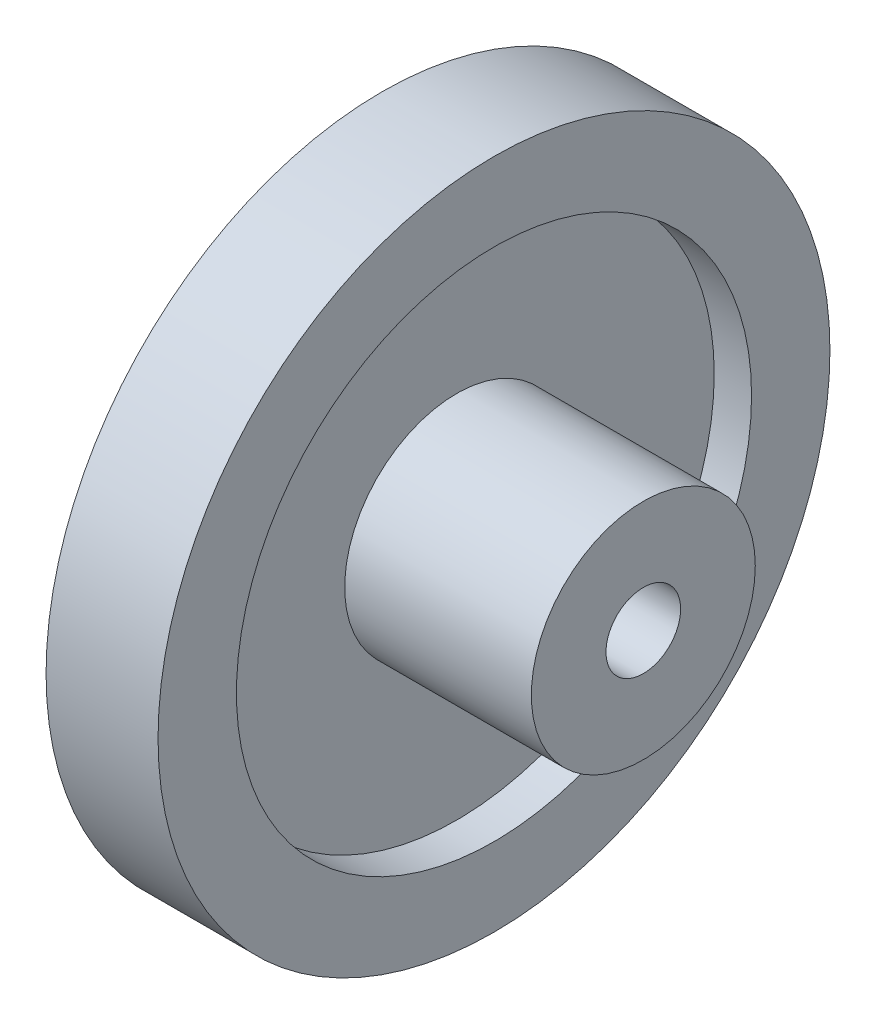
from build123d import *

# Parameters (mm, degrees)
ESQUISSE2_R             = 1
BOSS_EXTRU_1_DEPTH      = 3
ESQUISSE3_R             = 6.9
ENL_V_MAT_EXTRU_1_DEPTH = 1
ESQUISSE4_R             = 1
BOSS_EXTRU_2_DEPTH      = 5
BOSS_EXTRU_3_START      = -5
ESQUISSE6_R             = 3
ESQUISSE6_R_2           = 1
BOSS_EXTRU_3_DEPTH      = 5
BOSS_EXTRU_4_START      = -3
ESQUISSE7_R             = 9
ESQUISSE7_R_2           = 6.9
BOSS_EXTRU_4_DEPTH      = 3


with BuildPart() as part:
    # Esquisse2 → Boss.-Extru.1 (new body)
    with BuildSketch(Plane(origin=(0, 0, 0), x_dir=(0, 0, -1), z_dir=(1, 0, 0))):
        with BuildLine():
            ThreePointArc((8.992678526, 0.362950305), (8.983203595, 0.549593642), (8.969855294, 0.736000007))
            add(Edge.make_bspline(
                [(7.928017131, 0.973718567), (7.968735547, 0.978720051), (8.14599471, 0.972060465), (8.43210917, 0.923262044), (8.735368899, 0.829543111), (8.90576586, 0.762906571), (8.969855294, 0.736000007)],
                knots=[0, 0, 0, 0, 0.124841327, 0.52877899, 0.867841808, 1.076016146, 1.076016146, 1.076016146, 1.076016146], degree=3))
            ThreePointArc((7.928017131, 0.973718567), (7.845145349, 0.995861242), (7.801971612, 1.069983161))
            ThreePointArc((7.801971612, 1.069983161), (7.782401197, 1.204099918), (7.760525474, 1.337859996))
            ThreePointArc((7.760525474, 1.337859996), (7.7791127, 1.421320515), (7.851006147, 1.467607399))
            add(Edge.make_bspline(
                [(7.851006147, 1.467607399), (7.891911369, 1.47525391), (8.058869705, 1.535171146), (8.316858832, 1.668153777), (8.577616241, 1.849137964), (8.719907754, 1.964153953), (8.772869142, 2.009170729)],
                knots=[0, 0, 0, 0, 0.124841327, 0.52877899, 0.867841808, 1.076016146, 1.076016146, 1.076016146, 1.076016146], degree=3))
            ThreePointArc((8.772869142, 2.009170729), (8.729259916, 2.190895095), (8.681886815, 2.371674793))
            add(Edge.make_bspline(
                [(7.614107256, 2.413908484), (7.653213344, 2.426306797), (7.828678029, 2.452331888), (8.118887532, 2.456937748), (8.434204497, 2.420538386), (8.613944558, 2.38634682), (8.681886815, 2.371674793)],
                knots=[0, 0, 0, 0, 0.124841327, 0.52877899, 0.867841808, 1.076016146, 1.076016146, 1.076016146, 1.076016146], degree=3))
            ThreePointArc((7.614107256, 2.413908484), (7.528577818, 2.420446487), (7.472519329, 2.485373186))
            ThreePointArc((7.472519329, 2.485373186), (7.428638248, 2.613610296), (7.382556651, 2.741073201))
            ThreePointArc((7.382556651, 2.741073201), (7.385491564, 2.82652804), (7.447655696, 2.885237188))
            add(Edge.make_bspline(
                [(7.447655696, 2.885237188), (7.486459386, 2.900269817), (7.639565176, 2.989845363), (7.868726054, 3.167969089), (8.091787815, 3.393785724), (8.210522412, 3.532989345), (8.254310221, 3.586971254)],
                knots=[0, 0, 0, 0, 0.124841327, 0.52877899, 0.867841808, 1.076016146, 1.076016146, 1.076016146, 1.076016146], degree=3))
            ThreePointArc((8.254310221, 3.586971254), (8.17805176, 3.757588243), (8.098267094, 3.926585039))
            add(Edge.make_bspline(
                [(7.040908091, 3.771895641), (7.077070139, 3.791268575), (7.244765106, 3.849092091), (7.529186917, 3.906945383), (7.845823377, 3.92910513), (8.028785705, 3.928522889), (8.098267094, 3.926585039)],
                knots=[0, 0, 0, 0, 0.124841327, 0.52877899, 0.867841808, 1.076016146, 1.076016146, 1.076016146, 1.076016146], degree=3))
            ThreePointArc((7.040908091, 3.771895641), (6.955633599, 3.76260633), (6.888599363, 3.816126808))
            ThreePointArc((6.888599363, 3.816126808), (6.821901934, 3.93411731), (6.753183716, 4.050942446))
            ThreePointArc((6.753183716, 4.050942446), (6.740366371, 4.135481543), (6.790684263, 4.204613685))
            add(Edge.make_bspline(
                [(6.790684263, 4.204613685), (6.826065008, 4.226520515), (6.960104418, 4.342703981), (7.152633247, 4.559903013), (7.33040326, 4.822862182), (7.421537577, 4.981513022), (7.454660665, 5.042621775)],
                knots=[0, 0, 0, 0, 0.124841327, 0.52877899, 0.867841808, 1.076016146, 1.076016146, 1.076016146, 1.076016146], degree=3))
            ThreePointArc((7.454660665, 5.042621775), (7.34834986, 5.19632123), (7.2388706, 5.34778014))
            add(Edge.make_bspline(
                [(6.227939246, 5.001435417), (6.259925799, 5.027123248), (6.414140397, 5.114776078), (6.683088872, 5.223906679), (6.990262151, 5.303870911), (7.170216185, 5.336917824), (7.2388706, 5.34778014)],
                knots=[0, 0, 0, 0, 0.124841327, 0.52877899, 0.867841808, 1.076016146, 1.076016146, 1.076016146, 1.076016146], degree=3))
            ThreePointArc((6.227939246, 5.001435417), (6.14582362, 4.976635127), (6.070096408, 5.016926809))
            ThreePointArc((6.070096408, 5.016926809), (5.982853931, 5.120652678), (5.893839209, 5.222861704))
            ThreePointArc((5.893839209, 5.222861704), (5.865706085, 5.303606182), (5.902464222, 5.380807106))
            add(Edge.make_bspline(
                [(5.902464222, 5.380807106), (5.933217173, 5.408842125), (6.043625651, 5.547677024), (6.192966094, 5.79655491), (6.319390614, 6.087701853), (6.379821181, 6.260397247), (6.401151581, 6.32655186)],
                knots=[0, 0, 0, 0, 0.124841327, 0.52877899, 0.867841808, 1.076016146, 1.076016146, 1.076016146, 1.076016146], degree=3))
            ThreePointArc((6.401151581, 6.32655186), (6.268408719, 6.45809973), (6.13296305, 6.586863003))
            add(Edge.make_bspline(
                [(5.202885399, 6.060657308), (5.229607193, 6.091785269), (5.36508983, 6.206282501), (5.60940625, 6.362974098), (5.896655932, 6.498019729), (6.067473552, 6.563570423), (6.13296305, 6.586863003)],
                knots=[0, 0, 0, 0, 0.124841327, 0.52877899, 0.867841808, 1.076016146, 1.076016146, 1.076016146, 1.076016146], degree=3))
            ThreePointArc((5.202885399, 6.060657308), (5.126724989, 6.021190583), (5.044883599, 6.046881384))
            ThreePointArc((5.044883599, 6.046881384), (4.940067013, 6.13281036), (4.833787077, 6.216922671))
            ThreePointArc((4.833787077, 6.216922671), (4.791296214, 6.291122873), (4.813242841, 6.373763594))
            add(Edge.make_bspline(
                [(4.813242841, 6.373763594), (4.838320743, 6.406972104), (4.921338461, 6.563730579), (5.022404908, 6.835812081), (5.0931787, 7.145232139), (5.120847626, 7.326091153), (5.129658958, 7.395038808)],
                knots=[0, 0, 0, 0, 0.124841327, 0.52877899, 0.867841808, 1.076016146, 1.076016146, 1.076016146, 1.076016146], degree=3))
            ThreePointArc((5.129658958, 7.395038808), (4.975004437, 7.49995539), (4.818204799, 7.601638147))
            add(Edge.make_bspline(
                [(4.00065353, 6.913490784), (4.021200587, 6.948998848), (4.133337563, 7.086441417), (4.344702027, 7.285358066), (4.602246167, 7.470886279), (4.758110384, 7.566708503), (4.818204799, 7.601638147)],
                knots=[0, 0, 0, 0, 0.124841327, 0.52877899, 0.867841808, 1.076016146, 1.076016146, 1.076016146, 1.076016146], degree=3))
            ThreePointArc((4.00065353, 6.913490784), (3.933041887, 6.860701616), (3.84787333, 6.870916666))
            ThreePointArc((3.84787333, 6.870916666), (3.729052038, 6.936122541), (3.609126123, 6.999273793))
            ThreePointArc((3.609126123, 6.999273793), (3.553724497, 7.06440292), (3.560112248, 7.149669208))
            add(Edge.make_bspline(
                [(3.560112248, 7.149669208), (3.578661103, 7.186920332), (3.631460993, 7.356264162), (3.680811746, 7.64228387), (3.693524693, 7.959440113), (3.687489747, 8.142303811), (3.683481951, 8.21169658)],
                knots=[0, 0, 0, 0, 0.124841327, 0.52877899, 0.867841808, 1.076016146, 1.076016146, 1.076016146, 1.076016146], degree=3))
            ThreePointArc((3.683481951, 8.21169658), (3.512182346, 8.286409063), (3.339368362, 8.35754862))
            add(Edge.make_bspline(
                [(2.662184203, 7.530893622), (2.675856818, 7.569572607), (2.760829443, 7.72528007), (2.932044187, 7.959647903), (3.151112429, 8.189340757), (3.286715474, 8.3121714), (3.339368362, 8.35754862)],
                knots=[0, 0, 0, 0, 0.124841327, 0.52877899, 0.867841808, 1.076016146, 1.076016146, 1.076016146, 1.076016146], degree=3))
            ThreePointArc((2.662184203, 7.530893622), (2.605423761, 7.466579684), (2.51982835, 7.460971122))
            ThreePointArc((2.51982835, 7.460971122), (2.391048668, 7.503233388), (2.261560708, 7.543273041))
            ThreePointArc((2.261560708, 7.543273041), (2.195134954, 7.597113198), (2.185746302, 7.682101412))
            add(Edge.make_bspline(
                [(2.185746302, 7.682101412), (2.197134452, 7.722126608), (2.217918476, 7.898288992), (2.213872956, 8.188506848), (2.168092134, 8.502598901), (2.128558827, 8.681240079), (2.111868384, 8.748714873)],
                knots=[0, 0, 0, 0, 0.124841327, 0.52877899, 0.867841808, 1.076016146, 1.076016146, 1.076016146, 1.076016146], degree=3))
            ThreePointArc((2.111868384, 8.748714873), (1.929757098, 8.790679015), (1.74681374, 8.8288528))
            add(Edge.make_bspline(
                [(1.233057386, 7.891840911), (1.239389954, 7.932373648), (1.294304588, 8.101043575), (1.419539098, 8.362881478), (1.592671336, 8.628917058), (1.70339541, 8.77457327), (1.74681374, 8.8288528)],
                knots=[0, 0, 0, 0, 0.124841327, 0.52877899, 0.867841808, 1.076016146, 1.076016146, 1.076016146, 1.076016146], degree=3))
            ThreePointArc((1.233057386, 7.891840911), (1.189081054, 7.818192336), (1.105973638, 7.796951155))
            ThreePointArc((1.105973638, 7.796951155), (0.971621004, 7.81483062), (0.836980555, 7.830395172))
            ThreePointArc((0.836980555, 7.830395172), (0.761792723, 7.871112898), (0.736947387, 7.952928866))
            add(Edge.make_bspline(
                [(0.736947387, 7.952928866), (0.740787022, 7.994365125), (0.728847405, 8.171347063), (0.671543377, 8.455880046), (0.568827797, 8.756211882), (0.49714239, 8.924547128), (0.468337672, 8.987806174)],
                knots=[0, 0, 0, 0, 0.124841327, 0.52877899, 0.867841808, 1.076016146, 1.076016146, 1.076016146, 1.076016146], degree=3))
            ThreePointArc((0.468337672, 8.987806174), (0.281616286, 8.995592936), (0.094773472, 8.999500986))
            add(Edge.make_bspline(
                [(-0.238059721, 7.984041022), (-0.239282848, 8.02504722), (-0.216296258, 8.200935757), (-0.141306691, 8.481327153), (-0.020006268, 8.774645937), (0.062068259, 8.938167571), (0.094773472, 8.999500986)],
                knots=[0, 0, 0, 0, 0.124841327, 0.52877899, 0.867841808, 1.076016146, 1.076016146, 1.076016146, 1.076016146], degree=3))
            ThreePointArc((-0.238059721, 7.984041022), (-0.267754383, 7.903565825), (-0.34554368, 7.867415368))
            ThreePointArc((-0.34554368, 7.867415368), (-0.480894049, 7.860303169), (-0.616101967, 7.850862587))
            ThreePointArc((-0.616101967, 7.850862587), (-0.697491446, 7.877071289), (-0.736947387, 7.952928866))
            add(Edge.make_bspline(
                [(-0.736947387, 7.952928866), (-0.740787022, 7.994365125), (-0.78504369, 8.166139711), (-0.893654807, 8.435298391), (-1.049807289, 8.711642568), (-1.151203635, 8.863939428), (-1.191141718, 8.920828516)],
                knots=[0, 0, 0, 0, 0.124841327, 0.52877899, 0.867841808, 1.076016146, 1.076016146, 1.076016146, 1.076016146], degree=3))
            ThreePointArc((-1.191141718, 8.920828516), (-1.376114631, 8.894172728), (-1.560494193, 8.863681959))
            add(Edge.make_bspline(
                [(-1.70106999, 7.804354193), (-1.70980716, 7.844437433), (-1.719531394, 8.021554909), (-1.697340451, 8.310951405), (-1.632002584, 8.621564774), (-1.581372552, 8.797383295), (-1.560494193, 8.863681959)],
                knots=[0, 0, 0, 0, 0.124841327, 0.52877899, 0.867841808, 1.076016146, 1.076016146, 1.076016146, 1.076016146], degree=3))
            ThreePointArc((-1.70106999, 7.804354193), (-1.715471765, 7.719792859), (-1.785293922, 7.669964186))
            ThreePointArc((-1.785293922, 7.669964186), (-1.917032831, 7.638102521), (-2.048203875, 7.603978293))
            ThreePointArc((-2.048203875, 7.603978293), (-2.13302338, 7.614785465), (-2.185746302, 7.682101412))
            add(Edge.make_bspline(
                [(-2.185746302, 7.682101412), (-2.197134452, 7.722126608), (-2.272201064, 7.882844264), (-2.428420647, 8.127462766), (-2.632692446, 8.370408715), (-2.760346802, 8.501480902), (-2.810058205, 8.550062742)],
                knots=[0, 0, 0, 0, 0.124841327, 0.52877899, 0.867841808, 1.076016146, 1.076016146, 1.076016146, 1.076016146], degree=3))
            ThreePointArc((-2.810058205, 8.550062742), (-2.986983615, 8.489872136), (-3.1626211, 8.426020875))
            add(Edge.make_bspline(
                [(-3.106152361, 7.358899441), (-3.12210604, 7.396694737), (-3.164209951, 7.569009628), (-3.195573318, 7.857556174), (-3.188423008, 8.174886562), (-3.170961618, 8.357014683), (-3.1626211, 8.426020875)],
                knots=[0, 0, 0, 0, 0.124841327, 0.52877899, 0.867841808, 1.076016146, 1.076016146, 1.076016146, 1.076016146], degree=3))
            ThreePointArc((-3.106152361, 7.358899441), (-3.104770813, 7.273131606), (-3.164248122, 7.211321573))
            ThreePointArc((-3.164248122, 7.211321573), (-3.287889359, 7.155795453), (-3.410556657, 7.098149639))
            ThreePointArc((-3.410556657, 7.098149639), (-3.49591776, 7.093187254), (-3.560112248, 7.149669208))
            add(Edge.make_bspline(
                [(-3.560112248, 7.149669208), (-3.578661103, 7.186920332), (-3.681981355, 7.331108011), (-3.880489536, 7.542856145), (-4.125924419, 7.744130633), (-4.275489668, 7.84951464), (-4.33328153, 7.888134836)],
                knots=[0, 0, 0, 0, 0.124841327, 0.52877899, 0.867841808, 1.076016146, 1.076016146, 1.076016146, 1.076016146], degree=3))
            ThreePointArc((-4.33328153, 7.888134836), (-4.496134454, 7.79645913), (-4.657048739, 7.701421755))
            add(Edge.make_bspline(
                [(-4.405458438, 6.662846196), (-4.428085343, 6.697066474), (-4.501135134, 6.858710803), (-4.584984768, 7.136581292), (-4.636265512, 7.449822393), (-4.652567389, 7.632057959), (-4.657048739, 7.701421755)],
                knots=[0, 0, 0, 0, 0.124841327, 0.52877899, 0.867841808, 1.076016146, 1.076016146, 1.076016146, 1.076016146], degree=3))
            ThreePointArc((-4.405458438, 6.662846196), (-4.388340616, 6.578792579), (-4.435447646, 6.507106053))
            ThreePointArc((-4.435447646, 6.507106053), (-4.546780759, 6.429806352), (-4.656767022, 6.350602011))
            ThreePointArc((-4.656767022, 6.350602011), (-4.739762855, 6.330039059), (-4.813242841, 6.373763594))
            add(Edge.make_bspline(
                [(-4.813242841, 6.373763594), (-4.838320743, 6.406972104), (-4.966376188, 6.529719667), (-5.200413007, 6.701386604), (-5.478652985, 6.85413547), (-5.645035862, 6.930242572), (-5.70894015, 6.957585958)],
                knots=[0, 0, 0, 0, 0.124841327, 0.52877899, 0.867841808, 1.076016146, 1.076016146, 1.076016146, 1.076016146], degree=3))
            ThreePointArc((-5.70894015, 6.957585958), (-5.852174827, 6.83754706), (-5.992886168, 6.714559954))
            add(Edge.make_bspline(
                [(-5.554741912, 5.739897714), (-5.58327151, 5.769377644), (-5.684779557, 5.914846807), (-5.81826006, 6.172578694), (-5.926225553, 6.471063457), (-5.975735558, 6.647200654), (-5.992886168, 6.714559954)],
                knots=[0, 0, 0, 0, 0.124841327, 0.52877899, 0.867841808, 1.076016146, 1.076016146, 1.076016146, 1.076016146], degree=3))
            ThreePointArc((-5.554741912, 5.739897714), (-5.522470742, 5.660420661), (-5.555603321, 5.58129884))
            ThreePointArc((-5.555603321, 5.58129884), (-5.650836993, 5.484857908), (-5.744396771, 5.386792249))
            ThreePointArc((-5.744396771, 5.386792249), (-5.82220101, 5.351328976), (-5.902464222, 5.380807106))
            add(Edge.make_bspline(
                [(-5.902464222, 5.380807106), (-5.933217173, 5.408842125), (-6.081647036, 5.505969552), (-6.34324265, 5.63170938), (-6.644812595, 5.730730945), (-6.82234713, 5.774969405), (-6.89018766, 5.790104836)],
                knots=[0, 0, 0, 0, 0.124841327, 0.52877899, 0.867841808, 1.076016146, 1.076016146, 1.076016146, 1.076016146], degree=3))
            ThreePointArc((-6.89018766, 5.790104836), (-7.008926405, 5.645790525), (-7.124643046, 5.499041868))
            add(Edge.make_bspline(
                [(-6.514865313, 4.6214839), (-6.548326063, 4.645219578), (-6.674835631, 4.769559798), (-6.853401485, 4.998376331), (-7.014375092, 5.271940217), (-7.095407219, 5.435980904), (-7.124643046, 5.499041868)],
                knots=[0, 0, 0, 0, 0.124841327, 0.52877899, 0.867841808, 1.076016146, 1.076016146, 1.076016146, 1.076016146], degree=3))
            ThreePointArc((-6.514865313, 4.6214839), (-6.46853975, 4.549289907), (-6.486569587, 4.46542719))
            ThreePointArc((-6.486569587, 4.46542719), (-6.562460751, 4.353129207), (-6.636407979, 4.239541737))
            ThreePointArc((-6.636407979, 4.239541737), (-6.706371093, 4.190385802), (-6.790684263, 4.204613685))
            add(Edge.make_bspline(
                [(-6.790684263, 4.204613685), (-6.826065008, 4.226520515), (-6.989814688, 4.294720246), (-7.270060773, 4.370251048), (-7.584691081, 4.41217325), (-7.767331549, 4.423036581), (-7.836798093, 4.425448638)],
                knots=[0, 0, 0, 0, 0.124841327, 0.52877899, 0.867841808, 1.076016146, 1.076016146, 1.076016146, 1.076016146], degree=3))
            ThreePointArc((-7.836798093, 4.425448638), (-7.9269974, 4.261773366), (-8.013778751, 4.096260505))
            add(Edge.make_bspline(
                [(-7.253132789, 3.345690994), (-7.290385226, 3.362874131), (-7.437588183, 3.46185115), (-7.655158542, 3.653960257), (-7.863658499, 3.893287376), (-7.973453297, 4.039645344), (-8.013778751, 4.096260505)],
                knots=[0, 0, 0, 0, 0.124841327, 0.52877899, 0.867841808, 1.076016146, 1.076016146, 1.076016146, 1.076016146], degree=3))
            ThreePointArc((-7.253132789, 3.345690994), (-7.194330395, 3.283238541), (-7.196643507, 3.197490772))
            ThreePointArc((-7.196643507, 3.197490772), (-7.250607779, 3.073159911), (-7.302424271, 2.947918717))
            ThreePointArc((-7.302424271, 2.947918717), (-7.362163751, 2.886744066), (-7.447655696, 2.885237188))
            add(Edge.make_bspline(
                [(-7.447655696, 2.885237188), (-7.486459386, 2.900269817), (-7.659952585, 2.937219394), (-7.949305695, 2.959969057), (-8.266282009, 2.943364287), (-8.447808808, 2.920482551), (-8.516535767, 2.910089094)],
                knots=[0, 0, 0, 0, 0.124841327, 0.52877899, 0.867841808, 1.076016146, 1.076016146, 1.076016146, 1.076016146], degree=3))
            ThreePointArc((-8.516535767, 2.910089094), (-8.575124006, 2.732626625), (-8.630014832, 2.553985905))
            add(Edge.make_bspline(
                [(-7.744403527, 1.955964595), (-7.784179063, 1.966010038), (-7.94706259, 2.036253313), (-8.196228356, 2.185112949), (-8.445154448, 2.382053302), (-8.579972987, 2.505744507), (-8.630014832, 2.553985905)],
                knots=[0, 0, 0, 0, 0.124841327, 0.52877899, 0.867841808, 1.076016146, 1.076016146, 1.076016146, 1.076016146], degree=3))
            ThreePointArc((-7.744403527, 1.955964595), (-7.675126748, 1.905380425), (-7.661644363, 1.820667641))
            ThreePointArc((-7.661644363, 1.820667641), (-7.691844055, 1.68853784), (-7.719765264, 1.55590786))
            ThreePointArc((-7.719765264, 1.55590786), (-7.767246753, 1.484797724), (-7.851006147, 1.467607399))
            add(Edge.make_bspline(
                [(-7.851006147, 1.467607399), (-7.891911369, 1.47525391), (-8.069239983, 1.479695059), (-8.357846547, 1.448888871), (-8.666374618, 1.374322583), (-8.84060607, 1.318474991), (-8.906253029, 1.295629957)],
                knots=[0, 0, 0, 0, 0.124841327, 0.52877899, 0.867841808, 1.076016146, 1.076016146, 1.076016146, 1.076016146], degree=3))
            ThreePointArc((-8.906253029, 1.295629957), (-8.93123505, 1.110423563), (-8.952366108, 0.924738377))
            add(Edge.make_bspline(
                [(-7.971947891, 0.499630167), (-8.012892019, 0.502195832), (-8.185909312, 0.541313312), (-8.458185443, 0.641854241), (-8.73906079, 0.78970126), (-8.894311987, 0.886513545), (-8.952366108, 0.924738377)],
                knots=[0, 0, 0, 0, 0.124841327, 0.52877899, 0.867841808, 1.076016146, 1.076016146, 1.076016146, 1.076016146], degree=3))
            ThreePointArc((-7.971947891, 0.499630167), (-7.894555864, 0.462636863), (-7.865737109, 0.381843858))
            ThreePointArc((-7.865737109, 0.381843858), (-7.871143807, 0.246414639), (-7.874218909, 0.110912427))
            ThreePointArc((-7.874218909, 0.110912427), (-7.907825483, 0.032288375), (-7.987, 0))
            add(Edge.make_bspline(
                [(-7.987, 0), (-8.028613776, 0), (-8.203739092, -0.028218518), (-8.481770958, -0.111531489), (-8.771344233, -0.241520028), (-8.932347096, -0.328431654), (-8.992678526, -0.362950305)],
                knots=[0, 0, 0, 0, 0.124841327, 0.52877899, 0.867841808, 1.076016146, 1.076016146, 1.076016146, 1.076016146], degree=3))
            ThreePointArc((-8.992678526, -0.362950305), (-8.983203595, -0.549593642), (-8.969855294, -0.736000007))
            add(Edge.make_bspline(
                [(-7.928017131, -0.973718567), (-7.968735547, -0.978720051), (-8.14599471, -0.972060465), (-8.43210917, -0.923262044), (-8.735368899, -0.829543111), (-8.90576586, -0.762906571), (-8.969855294, -0.736000007)],
                knots=[0, 0, 0, 0, 0.124841327, 0.52877899, 0.867841808, 1.076016146, 1.076016146, 1.076016146, 1.076016146], degree=3))
            ThreePointArc((-7.928017131, -0.973718567), (-7.845145349, -0.995861242), (-7.801971612, -1.069983161))
            ThreePointArc((-7.801971612, -1.069983161), (-7.782401197, -1.204099918), (-7.760525474, -1.337859996))
            ThreePointArc((-7.760525474, -1.337859996), (-7.7791127, -1.421320515), (-7.851006147, -1.467607399))
            add(Edge.make_bspline(
                [(-7.851006147, -1.467607399), (-7.891911369, -1.47525391), (-8.058869705, -1.535171146), (-8.316858832, -1.668153777), (-8.577616241, -1.849137964), (-8.719907754, -1.964153953), (-8.772869142, -2.009170729)],
                knots=[0, 0, 0, 0, 0.124841327, 0.52877899, 0.867841808, 1.076016146, 1.076016146, 1.076016146, 1.076016146], degree=3))
            ThreePointArc((-8.772869142, -2.009170729), (-8.729259916, -2.190895095), (-8.681886815, -2.371674793))
            add(Edge.make_bspline(
                [(-7.614107256, -2.413908484), (-7.653213344, -2.426306797), (-7.828678029, -2.452331888), (-8.118887532, -2.456937748), (-8.434204497, -2.420538386), (-8.613944558, -2.38634682), (-8.681886815, -2.371674793)],
                knots=[0, 0, 0, 0, 0.124841327, 0.52877899, 0.867841808, 1.076016146, 1.076016146, 1.076016146, 1.076016146], degree=3))
            ThreePointArc((-7.614107256, -2.413908484), (-7.528577818, -2.420446487), (-7.472519329, -2.485373186))
            ThreePointArc((-7.472519329, -2.485373186), (-7.428638248, -2.613610296), (-7.382556651, -2.741073201))
            ThreePointArc((-7.382556651, -2.741073201), (-7.385491564, -2.82652804), (-7.447655696, -2.885237188))
            add(Edge.make_bspline(
                [(-7.447655696, -2.885237188), (-7.486459386, -2.900269817), (-7.639565176, -2.989845363), (-7.868726054, -3.167969089), (-8.091787815, -3.393785724), (-8.210522412, -3.532989345), (-8.254310221, -3.586971254)],
                knots=[0, 0, 0, 0, 0.124841327, 0.52877899, 0.867841808, 1.076016146, 1.076016146, 1.076016146, 1.076016146], degree=3))
            ThreePointArc((-8.254310221, -3.586971254), (-8.17805176, -3.757588243), (-8.098267094, -3.926585039))
            add(Edge.make_bspline(
                [(-7.040908091, -3.771895641), (-7.077070139, -3.791268575), (-7.244765106, -3.849092091), (-7.529186917, -3.906945383), (-7.845823377, -3.92910513), (-8.028785705, -3.928522889), (-8.098267094, -3.926585039)],
                knots=[0, 0, 0, 0, 0.124841327, 0.52877899, 0.867841808, 1.076016146, 1.076016146, 1.076016146, 1.076016146], degree=3))
            ThreePointArc((-7.040908091, -3.771895641), (-6.955633599, -3.76260633), (-6.888599363, -3.816126808))
            ThreePointArc((-6.888599363, -3.816126808), (-6.821901934, -3.93411731), (-6.753183716, -4.050942446))
            ThreePointArc((-6.753183716, -4.050942446), (-6.740366371, -4.135481543), (-6.790684263, -4.204613685))
            add(Edge.make_bspline(
                [(-6.790684263, -4.204613685), (-6.826065008, -4.226520515), (-6.960104418, -4.342703981), (-7.152633247, -4.559903013), (-7.33040326, -4.822862182), (-7.421537577, -4.981513022), (-7.454660665, -5.042621775)],
                knots=[0, 0, 0, 0, 0.124841327, 0.52877899, 0.867841808, 1.076016146, 1.076016146, 1.076016146, 1.076016146], degree=3))
            ThreePointArc((-7.454660665, -5.042621775), (-7.34834986, -5.19632123), (-7.2388706, -5.34778014))
            add(Edge.make_bspline(
                [(-6.227939246, -5.001435417), (-6.259925799, -5.027123248), (-6.414140397, -5.114776078), (-6.683088872, -5.223906679), (-6.990262151, -5.303870911), (-7.170216185, -5.336917824), (-7.2388706, -5.34778014)],
                knots=[0, 0, 0, 0, 0.124841327, 0.52877899, 0.867841808, 1.076016146, 1.076016146, 1.076016146, 1.076016146], degree=3))
            ThreePointArc((-6.227939246, -5.001435417), (-6.14582362, -4.976635127), (-6.070096408, -5.016926809))
            ThreePointArc((-6.070096408, -5.016926809), (-5.982853931, -5.120652678), (-5.893839209, -5.222861704))
            ThreePointArc((-5.893839209, -5.222861704), (-5.865706085, -5.303606182), (-5.902464222, -5.380807106))
            add(Edge.make_bspline(
                [(-5.902464222, -5.380807106), (-5.933217173, -5.408842125), (-6.043625651, -5.547677024), (-6.192966094, -5.79655491), (-6.319390614, -6.087701853), (-6.379821181, -6.260397247), (-6.401151581, -6.32655186)],
                knots=[0, 0, 0, 0, 0.124841327, 0.52877899, 0.867841808, 1.076016146, 1.076016146, 1.076016146, 1.076016146], degree=3))
            ThreePointArc((-6.401151581, -6.32655186), (-6.268408719, -6.45809973), (-6.13296305, -6.586863003))
            add(Edge.make_bspline(
                [(-5.202885399, -6.060657308), (-5.229607193, -6.091785269), (-5.36508983, -6.206282501), (-5.60940625, -6.362974098), (-5.896655932, -6.498019729), (-6.067473552, -6.563570423), (-6.13296305, -6.586863003)],
                knots=[0, 0, 0, 0, 0.124841327, 0.52877899, 0.867841808, 1.076016146, 1.076016146, 1.076016146, 1.076016146], degree=3))
            ThreePointArc((-5.202885399, -6.060657308), (-5.126724989, -6.021190583), (-5.044883599, -6.046881384))
            ThreePointArc((-5.044883599, -6.046881384), (-4.940067013, -6.13281036), (-4.833787077, -6.216922671))
            ThreePointArc((-4.833787077, -6.216922671), (-4.791296214, -6.291122873), (-4.813242841, -6.373763594))
            add(Edge.make_bspline(
                [(-4.813242841, -6.373763594), (-4.838320743, -6.406972104), (-4.921338461, -6.563730579), (-5.022404908, -6.835812081), (-5.0931787, -7.145232139), (-5.120847626, -7.326091153), (-5.129658958, -7.395038808)],
                knots=[0, 0, 0, 0, 0.124841327, 0.52877899, 0.867841808, 1.076016146, 1.076016146, 1.076016146, 1.076016146], degree=3))
            ThreePointArc((-5.129658958, -7.395038808), (-4.975004437, -7.49995539), (-4.818204799, -7.601638147))
            add(Edge.make_bspline(
                [(-4.00065353, -6.913490784), (-4.021200587, -6.948998848), (-4.133337563, -7.086441417), (-4.344702027, -7.285358066), (-4.602246167, -7.470886279), (-4.758110384, -7.566708503), (-4.818204799, -7.601638147)],
                knots=[0, 0, 0, 0, 0.124841327, 0.52877899, 0.867841808, 1.076016146, 1.076016146, 1.076016146, 1.076016146], degree=3))
            ThreePointArc((-4.00065353, -6.913490784), (-3.933041887, -6.860701616), (-3.84787333, -6.870916666))
            ThreePointArc((-3.84787333, -6.870916666), (-3.729052038, -6.936122541), (-3.609126123, -6.999273793))
            ThreePointArc((-3.609126123, -6.999273793), (-3.553724497, -7.06440292), (-3.560112248, -7.149669208))
            add(Edge.make_bspline(
                [(-3.560112248, -7.149669208), (-3.578661103, -7.186920332), (-3.631460993, -7.356264162), (-3.680811746, -7.64228387), (-3.693524693, -7.959440113), (-3.687489747, -8.142303811), (-3.683481951, -8.21169658)],
                knots=[0, 0, 0, 0, 0.124841327, 0.52877899, 0.867841808, 1.076016146, 1.076016146, 1.076016146, 1.076016146], degree=3))
            ThreePointArc((-3.683481951, -8.21169658), (-3.512182346, -8.286409063), (-3.339368362, -8.35754862))
            add(Edge.make_bspline(
                [(-2.662184203, -7.530893622), (-2.675856818, -7.569572607), (-2.760829443, -7.72528007), (-2.932044187, -7.959647903), (-3.151112429, -8.189340757), (-3.286715474, -8.3121714), (-3.339368362, -8.35754862)],
                knots=[0, 0, 0, 0, 0.124841327, 0.52877899, 0.867841808, 1.076016146, 1.076016146, 1.076016146, 1.076016146], degree=3))
            ThreePointArc((-2.662184203, -7.530893622), (-2.605423761, -7.466579684), (-2.51982835, -7.460971122))
            ThreePointArc((-2.51982835, -7.460971122), (-2.391048668, -7.503233388), (-2.261560708, -7.543273041))
            ThreePointArc((-2.261560708, -7.543273041), (-2.195134954, -7.597113198), (-2.185746302, -7.682101412))
            add(Edge.make_bspline(
                [(-2.185746302, -7.682101412), (-2.197134452, -7.722126608), (-2.217918476, -7.898288992), (-2.213872956, -8.188506848), (-2.168092134, -8.502598901), (-2.128558827, -8.681240079), (-2.111868384, -8.748714873)],
                knots=[0, 0, 0, 0, 0.124841327, 0.52877899, 0.867841808, 1.076016146, 1.076016146, 1.076016146, 1.076016146], degree=3))
            ThreePointArc((-2.111868384, -8.748714873), (-1.929757098, -8.790679015), (-1.74681374, -8.8288528))
            add(Edge.make_bspline(
                [(-1.233057386, -7.891840911), (-1.239389954, -7.932373648), (-1.294304588, -8.101043575), (-1.419539098, -8.362881478), (-1.592671336, -8.628917058), (-1.70339541, -8.77457327), (-1.74681374, -8.8288528)],
                knots=[0, 0, 0, 0, 0.124841327, 0.52877899, 0.867841808, 1.076016146, 1.076016146, 1.076016146, 1.076016146], degree=3))
            ThreePointArc((-1.233057386, -7.891840911), (-1.189081054, -7.818192336), (-1.105973638, -7.796951155))
            ThreePointArc((-1.105973638, -7.796951155), (-0.971621004, -7.81483062), (-0.836980555, -7.830395172))
            ThreePointArc((-0.836980555, -7.830395172), (-0.761792723, -7.871112898), (-0.736947387, -7.952928866))
            add(Edge.make_bspline(
                [(-0.736947387, -7.952928866), (-0.740787022, -7.994365125), (-0.728847405, -8.171347063), (-0.671543377, -8.455880046), (-0.568827797, -8.756211882), (-0.49714239, -8.924547128), (-0.468337672, -8.987806174)],
                knots=[0, 0, 0, 0, 0.124841327, 0.52877899, 0.867841808, 1.076016146, 1.076016146, 1.076016146, 1.076016146], degree=3))
            ThreePointArc((-0.468337672, -8.987806174), (-0.281616286, -8.995592936), (-0.094773472, -8.999500986))
            add(Edge.make_bspline(
                [(0.238059721, -7.984041022), (0.239282848, -8.02504722), (0.216296258, -8.200935757), (0.141306691, -8.481327153), (0.020006268, -8.774645937), (-0.062068259, -8.938167571), (-0.094773472, -8.999500986)],
                knots=[0, 0, 0, 0, 0.124841327, 0.52877899, 0.867841808, 1.076016146, 1.076016146, 1.076016146, 1.076016146], degree=3))
            ThreePointArc((0.238059721, -7.984041022), (0.267754383, -7.903565825), (0.34554368, -7.867415368))
            ThreePointArc((0.34554368, -7.867415368), (0.480894049, -7.860303169), (0.616101967, -7.850862587))
            ThreePointArc((0.616101967, -7.850862587), (0.697491446, -7.877071289), (0.736947387, -7.952928866))
            add(Edge.make_bspline(
                [(0.736947387, -7.952928866), (0.740787022, -7.994365125), (0.78504369, -8.166139711), (0.893654807, -8.435298391), (1.049807289, -8.711642568), (1.151203635, -8.863939428), (1.191141718, -8.920828516)],
                knots=[0, 0, 0, 0, 0.124841327, 0.52877899, 0.867841808, 1.076016146, 1.076016146, 1.076016146, 1.076016146], degree=3))
            ThreePointArc((1.191141718, -8.920828516), (1.376114631, -8.894172728), (1.560494193, -8.863681959))
            add(Edge.make_bspline(
                [(1.70106999, -7.804354193), (1.70980716, -7.844437433), (1.719531394, -8.021554909), (1.697340451, -8.310951405), (1.632002584, -8.621564774), (1.581372552, -8.797383295), (1.560494193, -8.863681959)],
                knots=[0, 0, 0, 0, 0.124841327, 0.52877899, 0.867841808, 1.076016146, 1.076016146, 1.076016146, 1.076016146], degree=3))
            ThreePointArc((1.70106999, -7.804354193), (1.715471765, -7.719792859), (1.785293922, -7.669964186))
            ThreePointArc((1.785293922, -7.669964186), (1.917032831, -7.638102521), (2.048203875, -7.603978293))
            ThreePointArc((2.048203875, -7.603978293), (2.13302338, -7.614785465), (2.185746302, -7.682101412))
            add(Edge.make_bspline(
                [(2.185746302, -7.682101412), (2.197134452, -7.722126608), (2.272201064, -7.882844264), (2.428420647, -8.127462766), (2.632692446, -8.370408715), (2.760346802, -8.501480902), (2.810058205, -8.550062742)],
                knots=[0, 0, 0, 0, 0.124841327, 0.52877899, 0.867841808, 1.076016146, 1.076016146, 1.076016146, 1.076016146], degree=3))
            ThreePointArc((2.810058205, -8.550062742), (2.986983615, -8.489872136), (3.1626211, -8.426020875))
            add(Edge.make_bspline(
                [(3.106152361, -7.358899441), (3.12210604, -7.396694737), (3.164209951, -7.569009628), (3.195573318, -7.857556174), (3.188423008, -8.174886562), (3.170961618, -8.357014683), (3.1626211, -8.426020875)],
                knots=[0, 0, 0, 0, 0.124841327, 0.52877899, 0.867841808, 1.076016146, 1.076016146, 1.076016146, 1.076016146], degree=3))
            ThreePointArc((3.106152361, -7.358899441), (3.104770813, -7.273131606), (3.164248122, -7.211321573))
            ThreePointArc((3.164248122, -7.211321573), (3.287889359, -7.155795453), (3.410556657, -7.098149639))
            ThreePointArc((3.410556657, -7.098149639), (3.49591776, -7.093187254), (3.560112248, -7.149669208))
            add(Edge.make_bspline(
                [(3.560112248, -7.149669208), (3.578661103, -7.186920332), (3.681981355, -7.331108011), (3.880489536, -7.542856145), (4.125924419, -7.744130633), (4.275489668, -7.84951464), (4.33328153, -7.888134836)],
                knots=[0, 0, 0, 0, 0.124841327, 0.52877899, 0.867841808, 1.076016146, 1.076016146, 1.076016146, 1.076016146], degree=3))
            ThreePointArc((4.33328153, -7.888134836), (4.496134454, -7.79645913), (4.657048739, -7.701421755))
            add(Edge.make_bspline(
                [(4.405458438, -6.662846196), (4.428085343, -6.697066474), (4.501135134, -6.858710803), (4.584984768, -7.136581292), (4.636265512, -7.449822393), (4.652567389, -7.632057959), (4.657048739, -7.701421755)],
                knots=[0, 0, 0, 0, 0.124841327, 0.52877899, 0.867841808, 1.076016146, 1.076016146, 1.076016146, 1.076016146], degree=3))
            ThreePointArc((4.405458438, -6.662846196), (4.388340616, -6.578792579), (4.435447646, -6.507106053))
            ThreePointArc((4.435447646, -6.507106053), (4.546780759, -6.429806352), (4.656767022, -6.350602011))
            ThreePointArc((4.656767022, -6.350602011), (4.739762855, -6.330039059), (4.813242841, -6.373763594))
            add(Edge.make_bspline(
                [(4.813242841, -6.373763594), (4.838320743, -6.406972104), (4.966376188, -6.529719667), (5.200413007, -6.701386604), (5.478652985, -6.85413547), (5.645035862, -6.930242572), (5.70894015, -6.957585958)],
                knots=[0, 0, 0, 0, 0.124841327, 0.52877899, 0.867841808, 1.076016146, 1.076016146, 1.076016146, 1.076016146], degree=3))
            ThreePointArc((5.70894015, -6.957585958), (5.852174827, -6.83754706), (5.992886168, -6.714559954))
            add(Edge.make_bspline(
                [(5.554741912, -5.739897714), (5.58327151, -5.769377644), (5.684779557, -5.914846807), (5.81826006, -6.172578694), (5.926225553, -6.471063457), (5.975735558, -6.647200654), (5.992886168, -6.714559954)],
                knots=[0, 0, 0, 0, 0.124841327, 0.52877899, 0.867841808, 1.076016146, 1.076016146, 1.076016146, 1.076016146], degree=3))
            ThreePointArc((5.554741912, -5.739897714), (5.522470742, -5.660420661), (5.555603321, -5.58129884))
            ThreePointArc((5.555603321, -5.58129884), (5.650836993, -5.484857908), (5.744396771, -5.386792249))
            ThreePointArc((5.744396771, -5.386792249), (5.82220101, -5.351328976), (5.902464222, -5.380807106))
            add(Edge.make_bspline(
                [(5.902464222, -5.380807106), (5.933217173, -5.408842125), (6.081647036, -5.505969552), (6.34324265, -5.63170938), (6.644812595, -5.730730945), (6.82234713, -5.774969405), (6.89018766, -5.790104836)],
                knots=[0, 0, 0, 0, 0.124841327, 0.52877899, 0.867841808, 1.076016146, 1.076016146, 1.076016146, 1.076016146], degree=3))
            ThreePointArc((6.89018766, -5.790104836), (7.008926405, -5.645790525), (7.124643046, -5.499041868))
            add(Edge.make_bspline(
                [(6.514865313, -4.6214839), (6.548326063, -4.645219578), (6.674835631, -4.769559798), (6.853401485, -4.998376331), (7.014375092, -5.271940217), (7.095407219, -5.435980904), (7.124643046, -5.499041868)],
                knots=[0, 0, 0, 0, 0.124841327, 0.52877899, 0.867841808, 1.076016146, 1.076016146, 1.076016146, 1.076016146], degree=3))
            ThreePointArc((6.514865313, -4.6214839), (6.46853975, -4.549289907), (6.486569587, -4.46542719))
            ThreePointArc((6.486569587, -4.46542719), (6.562460751, -4.353129207), (6.636407979, -4.239541737))
            ThreePointArc((6.636407979, -4.239541737), (6.706371093, -4.190385802), (6.790684263, -4.204613685))
            add(Edge.make_bspline(
                [(6.790684263, -4.204613685), (6.826065008, -4.226520515), (6.989814688, -4.294720246), (7.270060773, -4.370251048), (7.584691081, -4.41217325), (7.767331549, -4.423036581), (7.836798093, -4.425448638)],
                knots=[0, 0, 0, 0, 0.124841327, 0.52877899, 0.867841808, 1.076016146, 1.076016146, 1.076016146, 1.076016146], degree=3))
            ThreePointArc((7.836798093, -4.425448638), (7.9269974, -4.261773366), (8.013778751, -4.096260505))
            add(Edge.make_bspline(
                [(7.253132789, -3.345690994), (7.290385226, -3.362874131), (7.437588183, -3.46185115), (7.655158542, -3.653960257), (7.863658499, -3.893287376), (7.973453297, -4.039645344), (8.013778751, -4.096260505)],
                knots=[0, 0, 0, 0, 0.124841327, 0.52877899, 0.867841808, 1.076016146, 1.076016146, 1.076016146, 1.076016146], degree=3))
            ThreePointArc((7.253132789, -3.345690994), (7.194330395, -3.283238541), (7.196643507, -3.197490772))
            ThreePointArc((7.196643507, -3.197490772), (7.250607779, -3.073159911), (7.302424271, -2.947918717))
            ThreePointArc((7.302424271, -2.947918717), (7.362163751, -2.886744066), (7.447655696, -2.885237188))
            add(Edge.make_bspline(
                [(7.447655696, -2.885237188), (7.486459386, -2.900269817), (7.659952585, -2.937219394), (7.949305695, -2.959969057), (8.266282009, -2.943364287), (8.447808808, -2.920482551), (8.516535767, -2.910089094)],
                knots=[0, 0, 0, 0, 0.124841327, 0.52877899, 0.867841808, 1.076016146, 1.076016146, 1.076016146, 1.076016146], degree=3))
            ThreePointArc((8.516535767, -2.910089094), (8.575124006, -2.732626625), (8.630014832, -2.553985905))
            add(Edge.make_bspline(
                [(7.744403527, -1.955964595), (7.784179063, -1.966010038), (7.94706259, -2.036253313), (8.196228356, -2.185112949), (8.445154448, -2.382053302), (8.579972987, -2.505744507), (8.630014832, -2.553985905)],
                knots=[0, 0, 0, 0, 0.124841327, 0.52877899, 0.867841808, 1.076016146, 1.076016146, 1.076016146, 1.076016146], degree=3))
            ThreePointArc((7.744403527, -1.955964595), (7.675126748, -1.905380425), (7.661644363, -1.820667641))
            ThreePointArc((7.661644363, -1.820667641), (7.691844055, -1.68853784), (7.719765264, -1.55590786))
            ThreePointArc((7.719765264, -1.55590786), (7.767246753, -1.484797724), (7.851006147, -1.467607399))
            add(Edge.make_bspline(
                [(7.851006147, -1.467607399), (7.891911369, -1.47525391), (8.069239983, -1.479695059), (8.357846547, -1.448888871), (8.666374618, -1.374322583), (8.84060607, -1.318474991), (8.906253029, -1.295629957)],
                knots=[0, 0, 0, 0, 0.124841327, 0.52877899, 0.867841808, 1.076016146, 1.076016146, 1.076016146, 1.076016146], degree=3))
            ThreePointArc((8.906253029, -1.295629957), (8.93123505, -1.110423563), (8.952366108, -0.924738377))
            add(Edge.make_bspline(
                [(7.971947891, -0.499630167), (8.012892019, -0.502195832), (8.185909312, -0.541313312), (8.458185443, -0.641854241), (8.73906079, -0.78970126), (8.894311987, -0.886513545), (8.952366108, -0.924738377)],
                knots=[0, 0, 0, 0, 0.124841327, 0.52877899, 0.867841808, 1.076016146, 1.076016146, 1.076016146, 1.076016146], degree=3))
            ThreePointArc((7.971947891, -0.499630167), (7.894555864, -0.462636863), (7.865737109, -0.381843858))
            ThreePointArc((7.865737109, -0.381843858), (7.871143807, -0.246414639), (7.874218909, -0.110912427))
            ThreePointArc((7.874218909, -0.110912427), (7.907825483, -0.032288375), (7.987, 0))
            add(Edge.make_bspline(
                [(7.987, 0), (8.028613776, 0), (8.203739092, 0.028218518), (8.481770958, 0.111531489), (8.771344233, 0.241520028), (8.932347096, 0.328431654), (8.992678526, 0.362950305)],
                knots=[0, 0, 0, 0, 0.124841327, 0.52877899, 0.867841808, 1.076016146, 1.076016146, 1.076016146, 1.076016146], degree=3))
        make_face()
        Circle(ESQUISSE2_R, mode=Mode.SUBTRACT)
    extrude(amount=BOSS_EXTRU_1_DEPTH)

    # Esquisse3 → Enlèv. mat.-Extru.1 (cut)
    with BuildSketch(Plane(origin=(3, 0, 0), x_dir=(0, 0, -1), z_dir=(1, 0, 0))):
        Circle(ESQUISSE3_R)
    extrude(amount=-ENL_V_MAT_EXTRU_1_DEPTH, mode=Mode.SUBTRACT)

    # Esquisse4 → Boss.-Extru.2 (add)
    with BuildSketch(Plane(origin=(2, 0, 0), x_dir=(0, 0, -1), z_dir=(1, 0, 0))):
        with BuildLine():
            ThreePointArc((2.977310095, 0.368272455), (2.955741127, 0.513414445), (2.927100903, 0.657328154))
            add(Edge.make_bspline(
                [(2.211403727, 0.79214554), (2.222779445, 0.796220429), (2.274133198, 0.805614359), (2.359373738, 0.810478726), (2.538607422, 0.796225963), (2.732062921, 0.744216047), (2.878239296, 0.681280138), (2.927100903, 0.657328154)],
                knots=[0, 0, 0, 0, 0.036250587, 0.155621312, 0.255291203, 0.575254513, 0.744084786, 0.744084786, 0.744084786, 0.744084786], degree=3))
            add(Edge.make_bspline(
                [(2.211403727, 0.79214554), (2.132130324, 0.763749064), (1.99001212, 0.681956821), (1.750090704, 0.694113528), (1.707279056, 0.775127876)],
                knots=[0, 0, 0, 0, 0.252617676, 0.527509393, 0.527509393, 0.527509393, 0.527509393], degree=3))
            ThreePointArc((1.707279056, 0.775127876), (1.657764419, 0.876037746), (1.602292085, 0.973799299))
            add(Edge.make_bspline(
                [(1.90038092, 1.380707558), (1.832256922, 1.331212576), (1.684611138, 1.259880414), (1.559480437, 1.054813647), (1.602292085, 0.973799299)],
                knots=[0, 0, 0, 0, 0.252617676, 0.527509393, 0.527509393, 0.527509393, 0.527509393], degree=3))
            add(Edge.make_bspline(
                [(1.90038092, 1.380707558), (1.9101567, 1.387810078), (1.946851003, 1.424944725), (1.998895263, 1.49262786), (2.088102134, 1.648736761), (2.154127637, 1.837868182), (2.184488772, 1.994094501), (2.192229346, 2.04795764)],
                knots=[0, 0, 0, 0, 0.036250587, 0.155621312, 0.255291203, 0.575254513, 0.744084786, 0.744084786, 0.744084786, 0.744084786], degree=3))
            ThreePointArc((2.192229346, 2.04795764), (2.089467363, 2.152702055), (1.98170658, 2.25229639))
            add(Edge.make_bspline(
                [(1.32345173, 1.940689701), (1.33025972, 1.950672835), (1.366284165, 1.988457663), (1.432386008, 2.04249615), (1.585766668, 2.136316339), (1.772846116, 2.207949723), (1.928098087, 2.242953821), (1.98170658, 2.25229639)],
                knots=[0, 0, 0, 0, 0.036250587, 0.155621312, 0.255291203, 0.575254513, 0.744084786, 0.744084786, 0.744084786, 0.744084786], degree=3))
            add(Edge.make_bspline(
                [(1.32345173, 1.940689701), (1.27600923, 1.871120733), (1.209109462, 1.721414433), (1.007863426, 1.590227146), (0.925609036, 1.630605075)],
                knots=[0, 0, 0, 0, 0.252617676, 0.527509393, 0.527509393, 0.527509393, 0.527509393], degree=3))
            ThreePointArc((0.925609036, 1.630605075), (0.82623752, 1.683138901), (0.72389666, 1.729623839))
            add(Edge.make_bspline(
                [(0.72588092, 2.234031757), (0.699859868, 2.153947194), (0.622339913, 2.009454248), (0.641642271, 1.770001768), (0.72389666, 1.729623839)],
                knots=[0, 0, 0, 0, 0.252617676, 0.527509393, 0.527509393, 0.527509393, 0.527509393], degree=3))
            add(Edge.make_bspline(
                [(0.72588092, 2.234031757), (0.729614936, 2.245523876), (0.737474053, 2.297134806), (0.739795594, 2.382482461), (0.720206959, 2.561211698), (0.662454053, 2.753031049), (0.595189201, 2.897266624), (0.569791499, 2.945392614)],
                knots=[0, 0, 0, 0, 0.036250587, 0.155621312, 0.255291203, 0.575254513, 0.744084786, 0.744084786, 0.744084786, 0.744084786], degree=3))
            ThreePointArc((0.569791499, 2.945392614), (0.425088085, 2.969730648), (0.279367699, 2.986963958))
            add(Edge.make_bspline(
                [(-0.070013845, 2.347956359), (-0.070374004, 2.360034519), (-0.063438981, 2.411777724), (-0.041724492, 2.494349468), (0.027216945, 2.660406485), (0.136462351, 2.82832165), (0.241488941, 2.947895379), (0.279367699, 2.986963958)],
                knots=[0, 0, 0, 0, 0.036250587, 0.155621312, 0.255291203, 0.575254513, 0.744084786, 0.744084786, 0.744084786, 0.744084786], degree=3))
            add(Edge.make_bspline(
                [(-0.070013845, 2.347956359), (-0.06750402, 2.263787878), (-0.033631914, 2.103350241), (-0.119333425, 1.878928045), (-0.209612175, 1.863246558)],
                knots=[0, 0, 0, 0, 0.252617676, 0.527509393, 0.527509393, 0.527509393, 0.527509393], degree=3))
            ThreePointArc((-0.209612175, 1.863246558), (-0.320884028, 1.847338204), (-0.431002684, 1.824790861))
            add(Edge.make_bspline(
                [(-0.72588092, 2.234031757), (-0.699859868, 2.153947194), (-0.677644007, 1.991484859), (-0.521281435, 1.809109374), (-0.431002684, 1.824790861)],
                knots=[0, 0, 0, 0, 0.252617676, 0.527509393, 0.527509393, 0.527509393, 0.527509393], degree=3))
            add(Edge.make_bspline(
                [(-0.72588092, 2.234031757), (-0.729614936, 2.245523876), (-0.75359292, 2.291897469), (-0.801880846, 2.36230974), (-0.922782795, 2.495390819), (-1.082254463, 2.616629628), (-1.221452415, 2.693781371), (-1.270287335, 2.717787719)],
                knots=[0, 0, 0, 0, 0.036250587, 0.155621312, 0.255291203, 0.575254513, 0.744084786, 0.744084786, 0.744084786, 0.744084786], degree=3))
            ThreePointArc((-1.270287335, 2.717787719), (-1.401660393, 2.65242307), (-1.529680147, 2.580712818))
            add(Edge.make_bspline(
                [(-1.436736511, 1.858383491), (-1.44412725, 1.867943232), (-1.468930592, 1.913880668), (-1.499897654, 1.993446068), (-1.541728726, 2.168311777), (-1.552045394, 2.368370838), (-1.537360771, 2.526841097), (-1.529680147, 2.580712818)],
                knots=[0, 0, 0, 0, 0.036250587, 0.155621312, 0.255291203, 0.575254513, 0.744084786, 0.744084786, 0.744084786, 0.744084786], degree=3))
            add(Edge.make_bspline(
                [(-1.436736511, 1.858383491), (-1.385233029, 1.791764998), (-1.263527042, 1.681877747), (-1.200948963, 1.449942292), (-1.26476866, 1.384191185)],
                knots=[0, 0, 0, 0, 0.252617676, 0.527509393, 0.527509393, 0.527509393, 0.527509393], degree=3))
            ThreePointArc((-1.26476866, 1.384191185), (-1.345438785, 1.305917102), (-1.421273653, 1.222949796))
            add(Edge.make_bspline(
                [(-1.90038092, 1.380707558), (-1.832256922, 1.331212576), (-1.718790948, 1.212835941), (-1.48509335, 1.157198689), (-1.421273653, 1.222949796)],
                knots=[0, 0, 0, 0, 0.252617676, 0.527509393, 0.527509393, 0.527509393, 0.527509393], degree=3))
            add(Edge.make_bspline(
                [(-1.90038092, 1.380707558), (-1.9101567, 1.387810078), (-1.956813011, 1.411233197), (-2.037266059, 1.43981499), (-2.213300886, 1.476415463), (-2.413578559, 1.480764624), (-2.571540724, 1.461363192), (-2.625159582, 1.45208029)],
                knots=[0, 0, 0, 0, 0.036250587, 0.155621312, 0.255291203, 0.575254513, 0.744084786, 0.744084786, 0.744084786, 0.744084786], degree=3))
            ThreePointArc((-2.625159582, 1.45208029), (-2.693022242, 1.321980032), (-2.75444217, 1.188717096))
            add(Edge.make_bspline(
                [(-2.254674663, 0.658971294), (-2.266272971, 0.662361119), (-2.313340644, 0.684946248), (-2.385160892, 0.731114025), (-2.521786425, 0.847995669), (-2.64772455, 1.003782864), (-2.728990923, 1.140619401), (-2.75444217, 1.188717096)],
                knots=[0, 0, 0, 0, 0.036250587, 0.155621312, 0.255291203, 0.575254513, 0.744084786, 0.744084786, 0.744084786, 0.744084786], degree=3))
            add(Edge.make_bspline(
                [(-2.254674663, 0.658971294), (-2.173850103, 0.635348788), (-2.010797786, 0.617985118), (-1.823842817, 0.467127866), (-1.836826505, 0.376421826)],
                knots=[0, 0, 0, 0, 0.252617676, 0.527509393, 0.527509393, 0.527509393, 0.527509393], degree=3))
            ThreePointArc((-1.836826505, 0.376421826), (-1.856081655, 0.265680053), (-1.868666393, 0.153983476))
            add(Edge.make_bspline(
                [(-2.349, 0), (-2.264794108, 0), (-2.103418166, -0.029075083), (-1.881650081, 0.063277436), (-1.868666393, 0.153983476)],
                knots=[0, 0, 0, 0, 0.252617676, 0.527509393, 0.527509393, 0.527509393, 0.527509393], degree=3))
            add(Edge.make_bspline(
                [(-2.349, 0), (-2.361083529, 0), (-2.412597041, -0.00847419), (-2.494484881, -0.032640149), (-2.658413265, -0.106500419), (-2.822997679, -0.220702136), (-2.93938788, -0.329246056), (-2.977310095, -0.368272455)],
                knots=[0, 0, 0, 0, 0.036250587, 0.155621312, 0.255291203, 0.575254513, 0.744084786, 0.744084786, 0.744084786, 0.744084786], degree=3))
            ThreePointArc((-2.977310095, -0.368272455), (-2.955741127, -0.513414445), (-2.927100903, -0.657328154))
            add(Edge.make_bspline(
                [(-2.211403727, -0.79214554), (-2.222779445, -0.796220429), (-2.274133198, -0.805614359), (-2.359373738, -0.810478726), (-2.538607422, -0.796225963), (-2.732062921, -0.744216047), (-2.878239296, -0.681280138), (-2.927100903, -0.657328154)],
                knots=[0, 0, 0, 0, 0.036250587, 0.155621312, 0.255291203, 0.575254513, 0.744084786, 0.744084786, 0.744084786, 0.744084786], degree=3))
            add(Edge.make_bspline(
                [(-2.211403727, -0.79214554), (-2.132130324, -0.763749064), (-1.99001212, -0.681956821), (-1.750090704, -0.694113528), (-1.707279056, -0.775127876)],
                knots=[0, 0, 0, 0, 0.252617676, 0.527509393, 0.527509393, 0.527509393, 0.527509393], degree=3))
            ThreePointArc((-1.707279056, -0.775127876), (-1.657764419, -0.876037746), (-1.602292085, -0.973799299))
            add(Edge.make_bspline(
                [(-1.90038092, -1.380707558), (-1.832256922, -1.331212576), (-1.684611138, -1.259880414), (-1.559480437, -1.054813647), (-1.602292085, -0.973799299)],
                knots=[0, 0, 0, 0, 0.252617676, 0.527509393, 0.527509393, 0.527509393, 0.527509393], degree=3))
            add(Edge.make_bspline(
                [(-1.90038092, -1.380707558), (-1.9101567, -1.387810078), (-1.946851003, -1.424944725), (-1.998895263, -1.49262786), (-2.088102134, -1.648736761), (-2.154127637, -1.837868182), (-2.184488772, -1.994094501), (-2.192229346, -2.04795764)],
                knots=[0, 0, 0, 0, 0.036250587, 0.155621312, 0.255291203, 0.575254513, 0.744084786, 0.744084786, 0.744084786, 0.744084786], degree=3))
            ThreePointArc((-2.192229346, -2.04795764), (-2.089467363, -2.152702055), (-1.98170658, -2.25229639))
            add(Edge.make_bspline(
                [(-1.32345173, -1.940689701), (-1.33025972, -1.950672835), (-1.366284165, -1.988457663), (-1.432386008, -2.04249615), (-1.585766668, -2.136316339), (-1.772846116, -2.207949723), (-1.928098087, -2.242953821), (-1.98170658, -2.25229639)],
                knots=[0, 0, 0, 0, 0.036250587, 0.155621312, 0.255291203, 0.575254513, 0.744084786, 0.744084786, 0.744084786, 0.744084786], degree=3))
            add(Edge.make_bspline(
                [(-1.32345173, -1.940689701), (-1.27600923, -1.871120733), (-1.209109462, -1.721414433), (-1.007863426, -1.590227146), (-0.925609036, -1.630605075)],
                knots=[0, 0, 0, 0, 0.252617676, 0.527509393, 0.527509393, 0.527509393, 0.527509393], degree=3))
            ThreePointArc((-0.925609036, -1.630605075), (-0.82623752, -1.683138901), (-0.72389666, -1.729623839))
            add(Edge.make_bspline(
                [(-0.72588092, -2.234031757), (-0.699859868, -2.153947194), (-0.622339913, -2.009454248), (-0.641642271, -1.770001768), (-0.72389666, -1.729623839)],
                knots=[0, 0, 0, 0, 0.252617676, 0.527509393, 0.527509393, 0.527509393, 0.527509393], degree=3))
            add(Edge.make_bspline(
                [(-0.72588092, -2.234031757), (-0.729614936, -2.245523876), (-0.737474053, -2.297134806), (-0.739795594, -2.382482461), (-0.720206959, -2.561211698), (-0.662454053, -2.753031049), (-0.595189201, -2.897266624), (-0.569791499, -2.945392614)],
                knots=[0, 0, 0, 0, 0.036250587, 0.155621312, 0.255291203, 0.575254513, 0.744084786, 0.744084786, 0.744084786, 0.744084786], degree=3))
            ThreePointArc((-0.569791499, -2.945392614), (-0.425088085, -2.969730648), (-0.279367699, -2.986963958))
            add(Edge.make_bspline(
                [(0.070013845, -2.347956359), (0.070374004, -2.360034519), (0.063438981, -2.411777724), (0.041724492, -2.494349468), (-0.027216945, -2.660406485), (-0.136462351, -2.82832165), (-0.241488941, -2.947895379), (-0.279367699, -2.986963958)],
                knots=[0, 0, 0, 0, 0.036250587, 0.155621312, 0.255291203, 0.575254513, 0.744084786, 0.744084786, 0.744084786, 0.744084786], degree=3))
            add(Edge.make_bspline(
                [(0.070013845, -2.347956359), (0.06750402, -2.263787879), (0.033631914, -2.103350241), (0.119333425, -1.878928045), (0.209612175, -1.863246558)],
                knots=[0, 0, 0, 0, 0.252617676, 0.527509393, 0.527509393, 0.527509393, 0.527509393], degree=3))
            ThreePointArc((0.209612175, -1.863246558), (0.320884028, -1.847338204), (0.431002684, -1.824790861))
            add(Edge.make_bspline(
                [(0.72588092, -2.234031757), (0.699859868, -2.153947194), (0.677644007, -1.991484859), (0.521281435, -1.809109374), (0.431002684, -1.824790861)],
                knots=[0, 0, 0, 0, 0.252617676, 0.527509393, 0.527509393, 0.527509393, 0.527509393], degree=3))
            add(Edge.make_bspline(
                [(0.72588092, -2.234031757), (0.729614936, -2.245523876), (0.75359292, -2.291897469), (0.801880846, -2.36230974), (0.922782795, -2.495390819), (1.082254463, -2.616629628), (1.221452415, -2.693781371), (1.270287335, -2.717787719)],
                knots=[0, 0, 0, 0, 0.036250587, 0.155621312, 0.255291203, 0.575254513, 0.744084786, 0.744084786, 0.744084786, 0.744084786], degree=3))
            ThreePointArc((1.270287335, -2.717787719), (1.401660393, -2.65242307), (1.529680147, -2.580712818))
            add(Edge.make_bspline(
                [(1.436736511, -1.858383491), (1.44412725, -1.867943232), (1.468930592, -1.913880668), (1.499897654, -1.993446068), (1.541728726, -2.168311777), (1.552045394, -2.368370838), (1.537360771, -2.526841097), (1.529680147, -2.580712818)],
                knots=[0, 0, 0, 0, 0.036250587, 0.155621312, 0.255291203, 0.575254513, 0.744084786, 0.744084786, 0.744084786, 0.744084786], degree=3))
            add(Edge.make_bspline(
                [(1.436736511, -1.858383491), (1.385233029, -1.791764998), (1.263527042, -1.681877747), (1.200948963, -1.449942292), (1.26476866, -1.384191185)],
                knots=[0, 0, 0, 0, 0.252617676, 0.527509393, 0.527509393, 0.527509393, 0.527509393], degree=3))
            ThreePointArc((1.26476866, -1.384191185), (1.345438785, -1.305917102), (1.421273653, -1.222949796))
            add(Edge.make_bspline(
                [(1.90038092, -1.380707558), (1.832256922, -1.331212576), (1.718790948, -1.212835941), (1.48509335, -1.157198689), (1.421273653, -1.222949796)],
                knots=[0, 0, 0, 0, 0.252617676, 0.527509393, 0.527509393, 0.527509393, 0.527509393], degree=3))
            add(Edge.make_bspline(
                [(1.90038092, -1.380707558), (1.9101567, -1.387810078), (1.956813011, -1.411233197), (2.037266059, -1.43981499), (2.213300886, -1.476415463), (2.413578559, -1.480764624), (2.571540724, -1.461363192), (2.625159582, -1.45208029)],
                knots=[0, 0, 0, 0, 0.036250587, 0.155621312, 0.255291203, 0.575254513, 0.744084786, 0.744084786, 0.744084786, 0.744084786], degree=3))
            ThreePointArc((2.625159582, -1.45208029), (2.693022242, -1.321980032), (2.75444217, -1.188717096))
            add(Edge.make_bspline(
                [(2.254674663, -0.658971294), (2.266272971, -0.662361119), (2.313340644, -0.684946248), (2.385160892, -0.731114025), (2.521786425, -0.847995669), (2.64772455, -1.003782864), (2.728990923, -1.140619401), (2.75444217, -1.188717096)],
                knots=[0, 0, 0, 0, 0.036250587, 0.155621312, 0.255291203, 0.575254513, 0.744084786, 0.744084786, 0.744084786, 0.744084786], degree=3))
            add(Edge.make_bspline(
                [(2.254674663, -0.658971294), (2.173850103, -0.635348788), (2.010797786, -0.617985118), (1.823842817, -0.467127866), (1.836826505, -0.376421826)],
                knots=[0, 0, 0, 0, 0.252617676, 0.527509393, 0.527509393, 0.527509393, 0.527509393], degree=3))
            ThreePointArc((1.836826505, -0.376421826), (1.856081655, -0.265680053), (1.868666393, -0.153983476))
            add(Edge.make_bspline(
                [(2.349, 0), (2.264794108, 0), (2.103418166, 0.029075083), (1.881650081, -0.063277436), (1.868666393, -0.153983476)],
                knots=[0, 0, 0, 0, 0.252617676, 0.527509393, 0.527509393, 0.527509393, 0.527509393], degree=3))
            add(Edge.make_bspline(
                [(2.349, 0), (2.361083529, 0), (2.412597041, 0.00847419), (2.494484881, 0.032640149), (2.658413265, 0.106500419), (2.822997679, 0.220702136), (2.93938788, 0.329246056), (2.977310095, 0.368272455)],
                knots=[0, 0, 0, 0, 0.036250587, 0.155621312, 0.255291203, 0.575254513, 0.744084786, 0.744084786, 0.744084786, 0.744084786], degree=3))
        make_face()
        Circle(ESQUISSE4_R, mode=Mode.SUBTRACT)
    extrude(amount=BOSS_EXTRU_2_DEPTH)

    # Esquisse6 → Boss.-Extru.3 (add)
    with BuildSketch(Plane(origin=(7, 0, 0), x_dir=(0, 0, -1), z_dir=(1, 0, 0)).offset(BOSS_EXTRU_3_START)):
        Circle(ESQUISSE6_R)
        Circle(ESQUISSE6_R_2, mode=Mode.SUBTRACT)
    extrude(amount=BOSS_EXTRU_3_DEPTH)

    # Esquisse7 → Boss.-Extru.4 (add)
    with BuildSketch(Plane(origin=(3, 0, 0), x_dir=(0, 0, -1), z_dir=(1, 0, 0)).offset(BOSS_EXTRU_4_START)):
        Circle(ESQUISSE7_R)
        Circle(ESQUISSE7_R_2, mode=Mode.SUBTRACT)
    extrude(amount=BOSS_EXTRU_4_DEPTH)


solid = part.part
